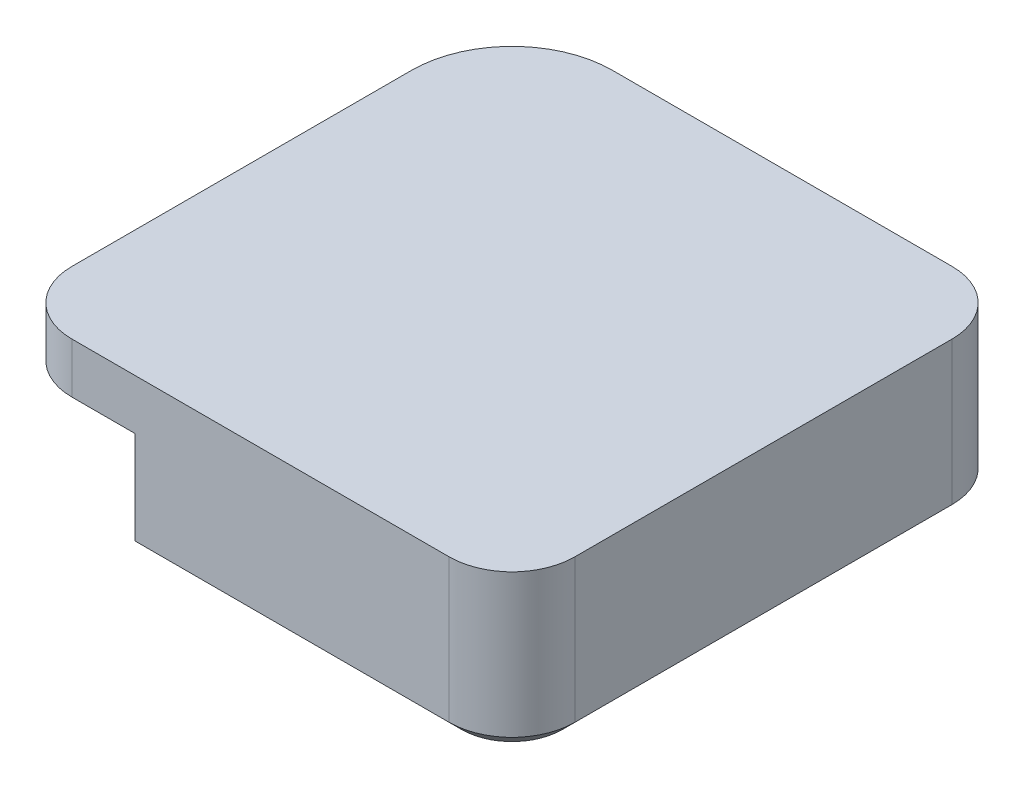
from build123d import *

# Parameters (mm, degrees)
SKETCH1_R           = 2.05
SKETCH1_R_2         = 2.1
SKETCH1_R_3         = 1.9
SKETCH1_R_4         = 1.75
SKETCH1_R_5         = 1.95
SKETCH1_R_6         = 2
SKETCH1_R_7         = 1.8
SKETCH1_R_8         = 1.85
BOSS_EXTRUDE1_DEPTH = 4.2
BOSS_EXTRUDE2_DEPTH = 2
CHAMFER1_SIZE       = 0.5


with BuildPart() as part:
    # Sketch1 → Boss-Extrude1 (new body)
    with BuildSketch(Plane(origin=(0, 0, 0), x_dir=(1, 0, 0), z_dir=(0, 1, 0))):
        with BuildLine():
            Line((0, 5), (5, 0))
            Line((5, 0), (17.5, 0))
            ThreePointArc((17.5, 0), (19.267766953, 0.732233047), (20, 2.5))
            Line((20, 2.5), (20, 17.5))
            ThreePointArc((20, 17.5), (19.267766953, 19.267766953), (17.5, 20))
            Line((17.5, 20), (4, 20))
            ThreePointArc((4, 20), (1.171572875, 18.828427125), (0, 16))
            Line((0, 16), (0, 5))
        make_face()
        with Locations(Location((10, 4, 0), (0, 0, 270))):
            Circle(SKETCH1_R, mode=Mode.SUBTRACT)
        with Locations(Location((16, 4, 0), (0, 0, 270))):
            Circle(SKETCH1_R_2, mode=Mode.SUBTRACT)
        with Locations(Location((4, 10, 0), (0, 0, 270))):
            Circle(SKETCH1_R_3, mode=Mode.SUBTRACT)
        with Locations(Location((4, 16, 0), (0, 0, 270))):
            Circle(SKETCH1_R_4, mode=Mode.SUBTRACT)
        with Locations(Location((10, 10, 0), (0, 0, 270))):
            Circle(SKETCH1_R_5, mode=Mode.SUBTRACT)
        with Locations(Location((16, 10, 0), (0, 0, 270))):
            Circle(SKETCH1_R_6, mode=Mode.SUBTRACT)
        with Locations(Location((10, 16, 0), (0, 0, 270))):
            Circle(SKETCH1_R_7, mode=Mode.SUBTRACT)
        with Locations(Location((16, 16, 0), (0, 0, 270))):
            Circle(SKETCH1_R_8, mode=Mode.SUBTRACT)
    extrude(amount=BOSS_EXTRUDE1_DEPTH)

    # Sketch2 → Boss-Extrude2 (add)
    with BuildSketch(Plane(origin=(0, 4.2, 0), x_dir=(1, 0, 0), z_dir=(0, 1, 0))):
        with BuildLine():
            Line((20, 17.5), (20, 2.5))
            ThreePointArc((20, 2.5), (19.267766953, 0.732233047), (17.5, 0))
            Line((17.5, 0), (2.5, 0))
            ThreePointArc((2.5, 0), (0.732233047, 0.732233047), (0, 2.5))
            Line((0, 2.5), (0, 5))
            Line((0, 5), (0, 16))
            ThreePointArc((0, 16), (1.171572875, 18.828427125), (4, 20))
            Line((4, 20), (17.5, 20))
            ThreePointArc((17.5, 20), (19.267766953, 19.267766953), (20, 17.5))
        make_face()
    extrude(amount=BOSS_EXTRUDE2_DEPTH)

    # Chamfer1
    chamfer1_edges = [part.edges().sort_by_distance(p)[0] for p in [
        (19.267766953, 0, -19.267766953),
        (20, 0, -10),
        (19.267766953, 0, -0.732233047),
        (11.25, 0, 0),
        (2.5, 0, -2.5),
        (0, 0, -10.5),
        (1.171572875, 0, -18.828427125),
        (10.75, 0, -20),
        (4, 0, -17.75),
        (10, 0, -17.8),
        (16, 0, -17.85),
        (4, 0, -11.9),
        (10, 0, -11.95),
        (16, 0, -12),
        (10, 0, -6.05),
        (16, 0, -6.1),
    ]]
    chamfer(chamfer1_edges, length=CHAMFER1_SIZE)


solid = part.part
